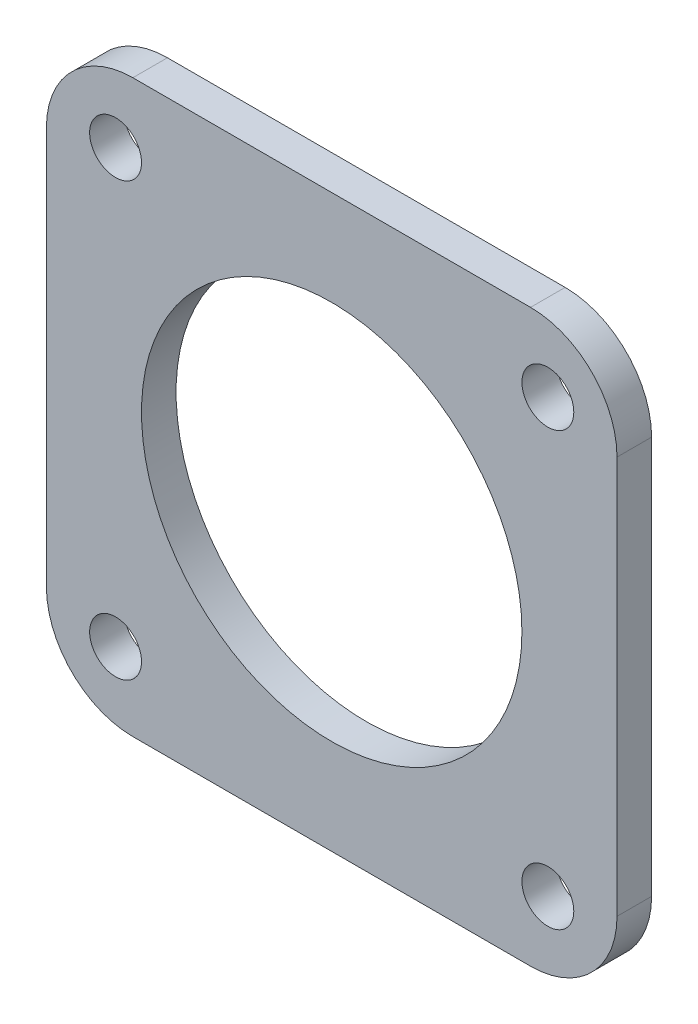
from build123d import *

# Parameters (mm, degrees)
SKETCH_1_W          = 33
SKETCH_1_H          = 33
EXTRUDE_1_DEPTH     = 2
SKETCH_2_R          = 1.5
CUT_EXTRUDE_1_DEPTH = 24.420076857
FILLET_1_R          = 5
SKETCH_3_R          = 11
CUT_EXTRUDE_2_DEPTH = 24.420076857


with BuildPart() as part:
    # 草图1 → 凸台-拉伸1 (new body)
    with BuildSketch(Plane.XY):
        Rectangle(SKETCH_1_W, SKETCH_1_H)
    extrude(amount=EXTRUDE_1_DEPTH)

    # 草图2 → 切除-拉伸1 (cut, through all)
    with BuildSketch(Plane.XY.offset(2)):
        with Locations((-12.5, 12.5)):
            Circle(SKETCH_2_R)
        with Locations((-12.5, -12.5)):
            Circle(SKETCH_2_R)
        with Locations((12.5, -12.5)):
            Circle(SKETCH_2_R)
        with Locations((12.5, 12.5)):
            Circle(SKETCH_2_R)
    extrude(amount=-CUT_EXTRUDE_1_DEPTH, mode=Mode.SUBTRACT)

    # 圆角1
    fillet_1_edges = [part.edges().sort_by_distance(p)[0] for p in [
        (16.5, -16.5, 1),
        (-16.5, -16.5, 1),
        (-16.5, 16.5, 1),
        (16.5, 16.5, 1),
    ]]
    fillet(fillet_1_edges, radius=FILLET_1_R)

    # 草图3 → 切除-拉伸2 (cut, through all)
    with BuildSketch(Plane.XY.offset(2)):
        Circle(SKETCH_3_R)
    extrude(amount=-CUT_EXTRUDE_2_DEPTH, mode=Mode.SUBTRACT)


solid = part.part
